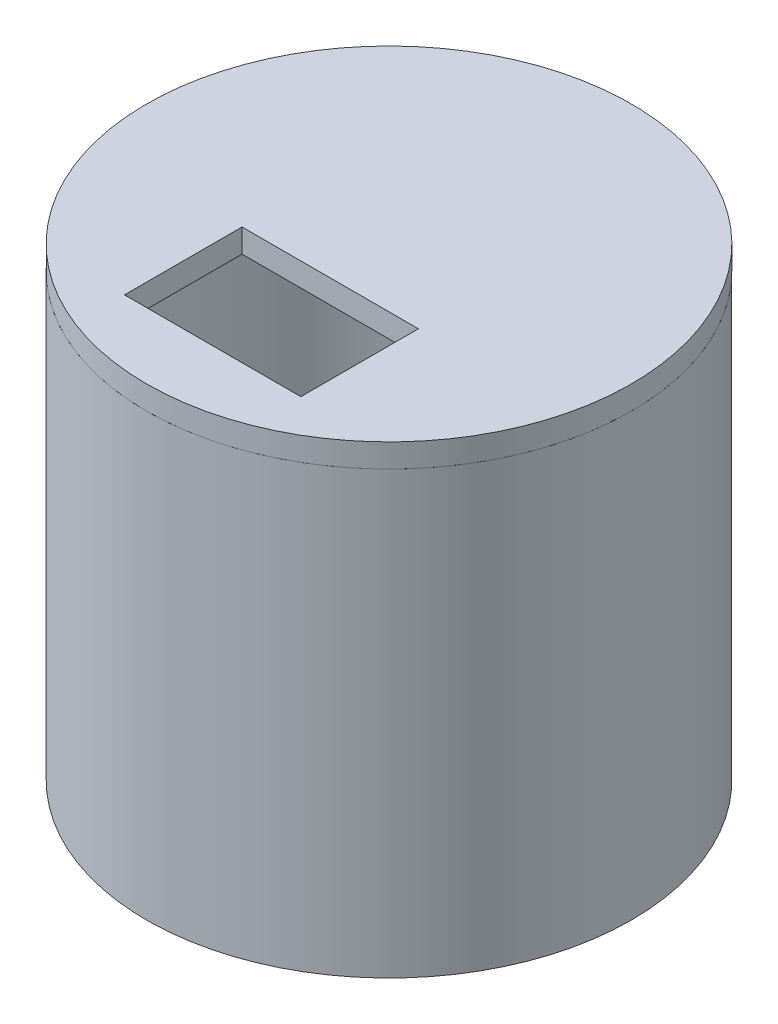
from build123d import *

# Parameters (mm, degrees)
SKETCH1_R           = 82.5
SKETCH1_R_2         = 80
EXTRUDE_THIN1_DEPTH = 150
SKETCH2_R           = 82.5
BOSS_EXTRUDE1_DEPTH = 8
SKETCH3_W           = 60
SKETCH3_H           = 40
CUT_EXTRUDE1_DEPTH  = 197.409012013


with BuildPart() as part:
    # Sketch1 → Extrude-Thin1 (new body)
    with BuildSketch(Plane(origin=(0, 0, 0), x_dir=(1, 0, 0), z_dir=(0, 1, 0))):
        Circle(SKETCH1_R)
        Circle(SKETCH1_R_2, mode=Mode.SUBTRACT)
    extrude(amount=EXTRUDE_THIN1_DEPTH)


with BuildPart() as body_2:
    # Sketch2 → Boss-Extrude1 (new body)
    with BuildSketch(Plane(origin=(0, 150, 0), x_dir=(1, 0, 0), z_dir=(0, 1, 0))):
        with Locations(Location((0, 0, 0), (0, 0, 270))):
            Circle(SKETCH2_R)
    extrude(amount=BOSS_EXTRUDE1_DEPTH)

    # Sketch3 → Cut-Extrude1 (cut, through all)
    with BuildSketch(Plane(origin=(0, 158, 0), x_dir=(1, 0, 0), z_dir=(0, 1, 0))):
        with Locations((0, -40)):
            Rectangle(SKETCH3_W, SKETCH3_H)
    extrude(amount=-CUT_EXTRUDE1_DEPTH, mode=Mode.SUBTRACT)


solid = Compound([part.part, body_2.part])
